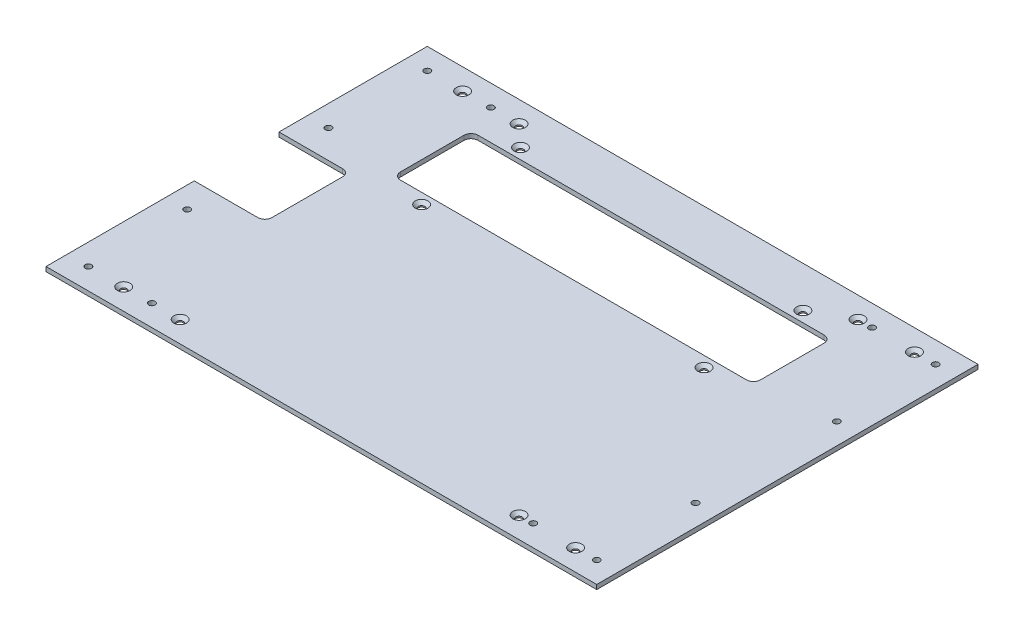
from build123d import *

# Parameters (mm, degrees)
SKETCH1_W                            = 390
SKETCH1_H                            = 270
BOSS_EXTRUDE1_DEPTH                  = 3.175
CSK_FOR_M4_SFHCS2_AT_2_COUNT         = 2
CSK_FOR_M4_SFHCS2_AT_2_PITCH         = 40
CSK_FOR_M4_SFHCS2_AT_3_COUNT         = 2
CSK_FOR_M4_SFHCS2_AT_3_PITCH         = 280
CSK_FOR_M4_SFHCS2_AT_4_COUNT         = 2
CSK_FOR_M4_SFHCS2_AT_4_PITCH         = 320
M4_CLEARANCE_HOLE1_D                 = 4.5
MIRROR3_AT_THE_SECOND_PLANE_COPY_1_D = 4.5
SKETCH10_W                           = 255
SKETCH10_H                           = 55
CUT_EXTRUDE1_DEPTH                   = 3.175
SKETCH11_W                           = 50
SKETCH11_H                           = 60
CUT_EXTRUDE2_DEPTH                   = 10
CSK_FOR_M4_SFHCS3_AT_2_COUNT         = 2
CSK_FOR_M4_SFHCS3_AT_2_PITCH         = 211.896201004
CSK_FOR_M4_SFHCS3_AT_3_COUNT         = 2
CSK_FOR_M4_SFHCS3_AT_3_PITCH         = 200
CSK_FOR_M4_SFHCS3_AT_4_COUNT         = 2
CSK_FOR_M4_SFHCS3_AT_4_PITCH         = 70
FILLET1_R                            = 5
FILLET2_R                            = 5


with BuildPart() as part:
    # Sketch1 → Boss-Extrude1 (new body)
    with BuildSketch(Plane(origin=(0, 0, 0), x_dir=(1, 0, 0), z_dir=(0, 1, 0))):
        Rectangle(SKETCH1_W, SKETCH1_H)
    extrude(amount=BOSS_EXTRUDE1_DEPTH)

    # Sketch6 → CSK for M4 SFHCS2 (revolve, cut)
    with BuildSketch(Plane(origin=(-155, 3.175, -120), x_dir=(0, 0, 1), z_dir=(1, 0, 0))):
        Polygon((0, 0), (0, 3.175), (2.25, 3.175), (2.25, 2.23), (4.48, 0), align=None)
    csk_for_m4_sfhcs2 = revolve(axis=Axis((-155, 9.525, -120), (0, -1, 0)), mode=Mode.SUBTRACT)

    # CSK for M4 SFHCS2 at 2: CSK for M4 SFHCS2 ×2
    with Locations(*[(i * CSK_FOR_M4_SFHCS2_AT_2_PITCH, 0, 0) for i in range(1, CSK_FOR_M4_SFHCS2_AT_2_COUNT)]):
        add(csk_for_m4_sfhcs2, mode=Mode.SUBTRACT)

    # CSK for M4 SFHCS2 at 3: CSK for M4 SFHCS2 ×2
    with Locations(*[(i * CSK_FOR_M4_SFHCS2_AT_3_PITCH, 0, 0) for i in range(1, CSK_FOR_M4_SFHCS2_AT_3_COUNT)]):
        add(csk_for_m4_sfhcs2, mode=Mode.SUBTRACT)

    # CSK for M4 SFHCS2 at 4: CSK for M4 SFHCS2 ×2
    with Locations(*[(i * CSK_FOR_M4_SFHCS2_AT_4_PITCH, 0, 0) for i in range(1, CSK_FOR_M4_SFHCS2_AT_4_COUNT)]):
        add(csk_for_m4_sfhcs2, mode=Mode.SUBTRACT)

    # Mirror2: CSK for M4 SFHCS2 across plane
    add(csk_for_m4_sfhcs2.mirror(Plane.XY), mode=Mode.SUBTRACT)

    # Mirror2 copy 1 sketch → Mirror2 copy 1 (revolve, cut)
    with BuildSketch(Plane(origin=(-115, 3.175, 120), x_dir=(0, 0, -1), z_dir=(1, 0, 0))):
        Polygon((0, 0), (0, -3.175), (2.25, -3.175), (2.25, -2.23), (4.48, 0), align=None)
    revolve(axis=Axis((-115, 9.525, 120), (0, 1, 0)), mode=Mode.SUBTRACT)

    # Mirror2 copy 2 sketch → Mirror2 copy 2 (revolve, cut)
    with BuildSketch(Plane(origin=(125, 3.175, 120), x_dir=(0, 0, -1), z_dir=(1, 0, 0))):
        Polygon((0, 0), (0, -3.175), (2.25, -3.175), (2.25, -2.23), (4.48, 0), align=None)
    revolve(axis=Axis((125, 9.525, 120), (0, 1, 0)), mode=Mode.SUBTRACT)

    # Mirror2 copy 3 sketch → Mirror2 copy 3 (revolve, cut)
    with BuildSketch(Plane(origin=(165, 3.175, 120), x_dir=(0, 0, -1), z_dir=(1, 0, 0))):
        Polygon((0, 0), (0, -3.175), (2.25, -3.175), (2.25, -2.23), (4.48, 0), align=None)
    revolve(axis=Axis((165, 9.525, 120), (0, 1, 0)), mode=Mode.SUBTRACT)

    # M4 Clearance Hole1 (through all)
    with Locations(Plane(origin=(0, 3.175, 0), x_dir=(1, 0, 0), z_dir=(0, 1, 0))):
        with Locations((-180, 120), (-180, 50), (-135, 120)):
            m4_clearance_hole1 = Hole(M4_CLEARANCE_HOLE1_D / 2)

    # Mirror3: M4 Clearance Hole1 across plane
    add(m4_clearance_hole1.mirror(Plane(origin=(0, 0, 0), x_dir=(0, 0, 1), z_dir=(1, 0, 0))), mode=Mode.SUBTRACT)

    # Mirror3 at the second plane: M4 Clearance Hole1 across plane
    add(m4_clearance_hole1.mirror(Plane.XY), mode=Mode.SUBTRACT)

    # Mirror3 at the second plane copy 1 (through all)
    with Locations(Plane(origin=(0, 3.175, 0), x_dir=(-1, 0, 0), z_dir=(0, 1, 0))):
        with Locations((-180, 120), (-180, 50), (-135, 120)):
            Hole(MIRROR3_AT_THE_SECOND_PLANE_COPY_1_D / 2)

    # Sketch10 → Cut-Extrude1 (cut)
    with BuildSketch(Plane(origin=(0, 3.175, 0), x_dir=(1, 0, 0), z_dir=(0, 1, 0))):
        with Locations((0, 71)):
            Rectangle(SKETCH10_W, SKETCH10_H)
    extrude(amount=-CUT_EXTRUDE1_DEPTH, mode=Mode.SUBTRACT)

    # Sketch11 → Cut-Extrude2 (cut)
    with BuildSketch(Plane(origin=(0, 3.175, 0), x_dir=(1, 0, 0), z_dir=(0, 1, 0))):
        with Locations((-170, 0)):
            Rectangle(SKETCH11_W, SKETCH11_H)
    extrude(amount=-CUT_EXTRUDE2_DEPTH, mode=Mode.SUBTRACT)

    # Sketch13 → CSK for M4 SFHCS3 (revolve, cut)
    with BuildSketch(Plane(origin=(100, 3.175, -106), x_dir=(0, 0, 1), z_dir=(1, 0, 0))):
        Polygon((0, 0), (0, 3.175), (2.25, 3.175), (2.25, 2.23), (4.48, 0), align=None)
    csk_for_m4_sfhcs3 = revolve(axis=Axis((100, 9.525, -106), (0, -1, 0)), mode=Mode.SUBTRACT)

    # CSK for M4 SFHCS3 at 2: CSK for M4 SFHCS3 ×2
    with Locations(*[Vector(-0.9438583563660174, 0, 0.33035042472810616) * (i * CSK_FOR_M4_SFHCS3_AT_2_PITCH) for i in range(1, CSK_FOR_M4_SFHCS3_AT_2_COUNT)]):
        add(csk_for_m4_sfhcs3, mode=Mode.SUBTRACT)

    # CSK for M4 SFHCS3 at 3: CSK for M4 SFHCS3 ×2
    with Locations(*[(-i * CSK_FOR_M4_SFHCS3_AT_3_PITCH, 0, 0) for i in range(1, CSK_FOR_M4_SFHCS3_AT_3_COUNT)]):
        add(csk_for_m4_sfhcs3, mode=Mode.SUBTRACT)

    # CSK for M4 SFHCS3 at 4: CSK for M4 SFHCS3 ×2
    with Locations(*[(0, 0, i * CSK_FOR_M4_SFHCS3_AT_4_PITCH) for i in range(1, CSK_FOR_M4_SFHCS3_AT_4_COUNT)]):
        add(csk_for_m4_sfhcs3, mode=Mode.SUBTRACT)

    # Fillet1
    fillet1_edges = [part.edges().sort_by_distance(p)[0] for p in [
        (127.5, 1.5875, -98.5),
        (127.5, 1.5875, -43.5),
        (-127.5, 1.5875, -43.5),
        (-127.5, 1.5875, -98.5),
    ]]
    fillet(fillet1_edges, radius=FILLET1_R)

    # Fillet2
    fillet2_edges = [part.edges().sort_by_distance(p)[0] for p in [
        (-145, 1.5875, -30),
        (-145, 1.5875, 30),
    ]]
    fillet(fillet2_edges, radius=FILLET2_R)


solid = part.part
